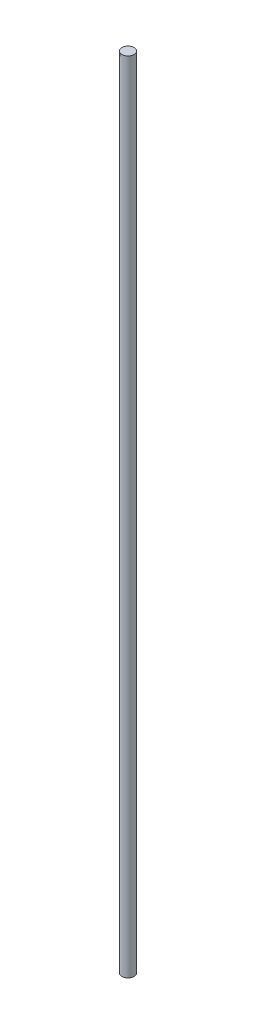
from build123d import *

# Parameters (mm, degrees)
SKETCH1_R           = 3.05
BOSS_EXTRUDE1_DEPTH = 400


with BuildPart() as part:
    # Sketch1 → Boss-Extrude1 (new body)
    with BuildSketch(Plane(origin=(0, 0, 0), x_dir=(1, 0, 0), z_dir=(0, 1, 0))):
        with Locations(Location((0, 0, 0), (0, 0, 270))):
            Circle(SKETCH1_R)
    extrude(amount=BOSS_EXTRUDE1_DEPTH)


solid = part.part
